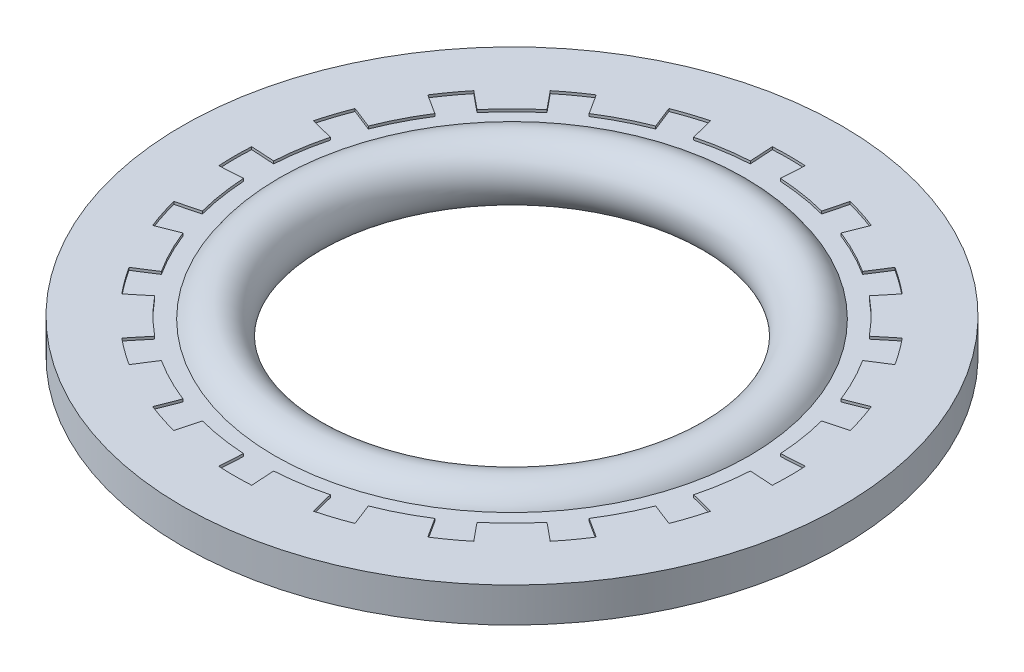
from build123d import *

# Parameters (mm, degrees)
SKETCH2_W          = 2.2165564
SKETCH2_H          = 1.016
CUT_EXTRUDE1_DEPTH = 14.687748683
CIRPATTERN1_COUNT  = 20


with BuildPart() as part:
    # Sketch2 → Revolve1 (revolve)
    with BuildSketch(Plane.XY, mode=Mode.PRIVATE) as revolve1_sk:
        with Locations((-8.5437218, 0)):
            Rectangle(SKETCH2_W, SKETCH2_H)
    revolve(revolve1_sk.sketch.rotate(Axis((0, 0, 0), (0, 1, 0)), 270), axis=Axis((0, 0, 0), (0, 1, 0)))

    # Sketch3 → Cut-Extrude1 (cut, through all)
    with BuildSketch(Plane(origin=(0, 0.508, 0), x_dir=(1, 0, 0), z_dir=(0, 1, 0))):
        with BuildLine():
            Line((-0.441893739, 7.422300954), (-0.4826, 8.106026683))
            ThreePointArc((-0.4826, 8.106026683), (0, 8.12038), (0.4826, 8.106026683))
            Line((0.4826, 8.106026683), (0.441893739, 7.422300954))
            ThreePointArc((0.441893739, 7.422300954), (0, 7.4354436), (-0.441893739, 7.422300954))
        make_face()
    cut_extrude1 = extrude(amount=-CUT_EXTRUDE1_DEPTH, mode=Mode.SUBTRACT)

    # CirPattern1: Cut-Extrude1 ×20 about axis
    cirpattern1_axis = Axis((0, 0, 0), (0, 1, 0))
    for i in range(1, CIRPATTERN1_COUNT):
        add(cut_extrude1.rotate(cirpattern1_axis, i * 360 / CIRPATTERN1_COUNT), mode=Mode.SUBTRACT)

    # Sketch4 → Revolve2 (revolve)
    with BuildSketch(Plane.XY, mode=Mode.PRIVATE) as revolve2_sk:
        with BuildLine():
            Line((-8.12038, -0.4318), (-6.945499539, -0.4318))
            ThreePointArc((-6.945499539, -0.4318), (-5.334, 0), (-6.945499539, 0.4318))
            Line((-6.945499539, 0.4318), (-8.12038, 0.4318))
            Line((-8.12038, 0.4318), (-8.12038, -0.4318))
        make_face()
    revolve(revolve2_sk.sketch.rotate(Axis((0, 0, 0), (0, 1, 0)), 270), axis=Axis((0, 0, 0), (0, 1, 0)))


solid = part.part
